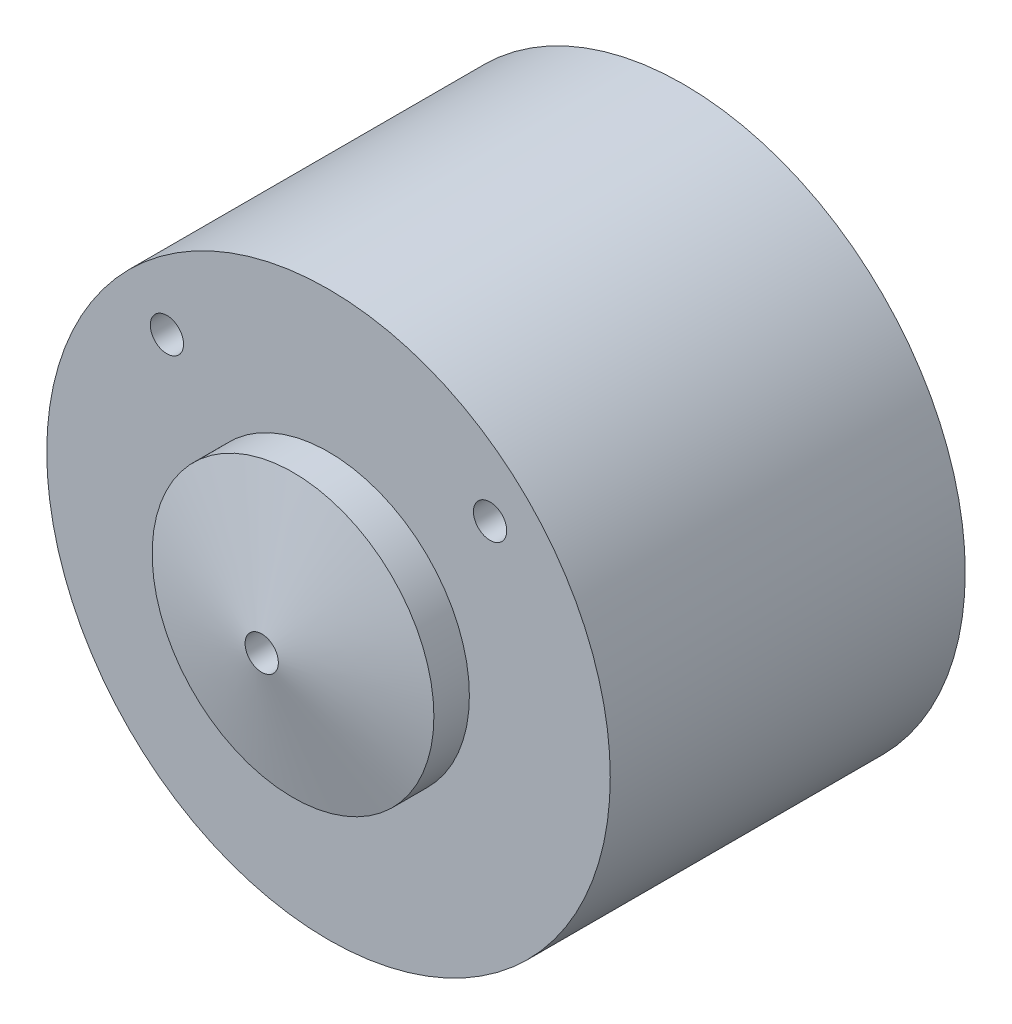
from build123d import *

# Parameters (mm, degrees)
SKETCH_1_R               = 12.7
EXTRUDE_1_DEPTH          = 16
SKETCH_2_R               = 6.35
EXTRUDE_2_DEPTH          = 1.6
SKETCH_3_R               = 6.35
EXTRUDE_3_DEPTH          = 1.6
EXTRUDE_3_TAPER          = 75.857
CUT_EXTRUDE_1_DEPTH      = 25.053689946
CUT_EXTRUDE_1_DEPTH_BACK = 25.053689946
SKETCH_4_R               = 0.75
SKETCH_5_R               = 0.75
CUT_EXTRUDE_5_DEPTH      = 27.153424276


with BuildPart() as part:
    # Эскиз1 → Бобышка-Вытянуть1 (new body)
    with BuildSketch(Plane.XY):
        Circle(SKETCH_1_R)
    extrude(amount=EXTRUDE_1_DEPTH)

    # Эскиз2 → Бобышка-Вытянуть2 (add)
    with BuildSketch(Plane.XY.offset(16)):
        Circle(SKETCH_2_R)
    extrude(amount=EXTRUDE_2_DEPTH)

    # Эскиз3 → Бобышка-Вытянуть3 (add)
    with BuildSketch(Plane.XY.offset(17.6)):
        Circle(SKETCH_3_R)
    extrude(amount=EXTRUDE_3_DEPTH, taper=EXTRUDE_3_TAPER)

    # Эскиз4 → Вырез-Вытянуть1 (cut, two sides: drawn at the far end of the back side and taken through both)
    with BuildSketch(Plane.XY.offset(16).offset(-CUT_EXTRUDE_1_DEPTH_BACK)):
        Circle(SKETCH_4_R)
    extrude(amount=CUT_EXTRUDE_1_DEPTH + CUT_EXTRUDE_1_DEPTH_BACK, mode=Mode.SUBTRACT)

    # Эскиз5 → Вырез-Вытянуть5 (cut, through all)
    with BuildSketch(Plane.XY):
        with Locations((-7.283199846, 7.283199846)):
            Circle(SKETCH_5_R)
        with Locations((7.283199846, 7.283199846)):
            Circle(SKETCH_5_R)
    extrude(amount=CUT_EXTRUDE_5_DEPTH, mode=Mode.SUBTRACT)


solid = part.part
